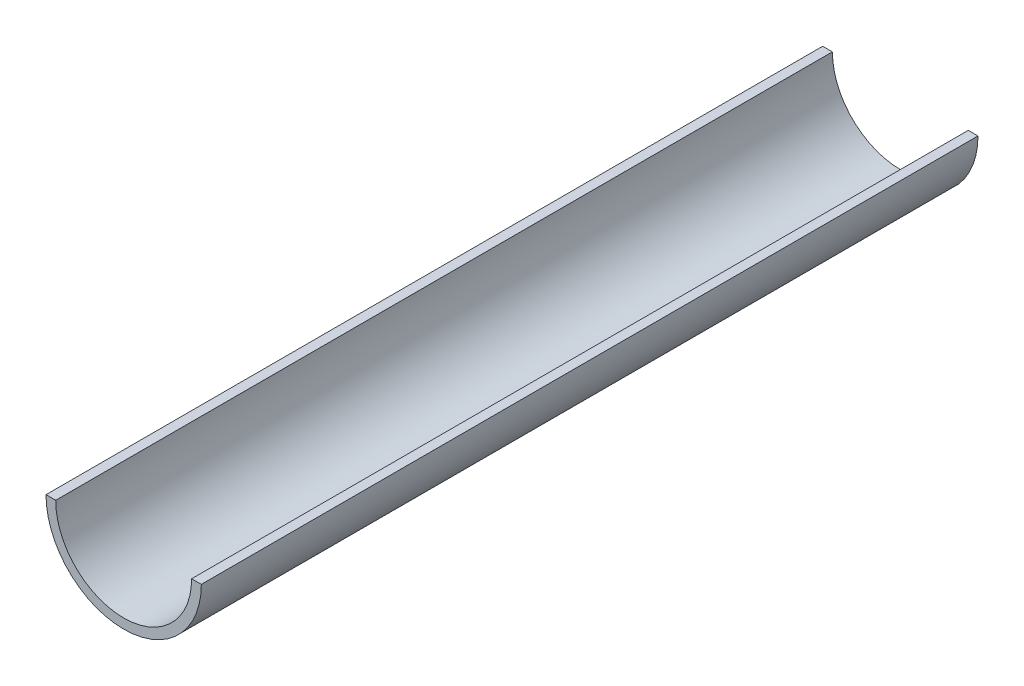
from build123d import *

# Parameters (mm, degrees)
SKETCH1_R           = 25.4
SKETCH1_R_2         = 22.225
BOSS_EXTRUDE1_DEPTH = 914.4
CUT_EXTRUDE1_START  = -254
SKETCH2_R           = 25.4
CUT_EXTRUDE1_DEPTH  = 662.10528356
CUT_EXTRUDE3_DEPTH  = 257.527425434


with BuildPart() as part:
    # Sketch1 → Boss-Extrude1 (new body)
    with BuildSketch(Plane.XY):
        Circle(SKETCH1_R)
        Circle(SKETCH1_R_2, mode=Mode.SUBTRACT)
    extrude(amount=BOSS_EXTRUDE1_DEPTH)

    # Sketch2 → Cut-Extrude1 (cut, through all)
    with BuildSketch(Plane(origin=(0, 0, 0), x_dir=(-1, 0, 0), z_dir=(0, 0, -1)).offset(CUT_EXTRUDE1_START)):
        Circle(SKETCH2_R)
    extrude(amount=-CUT_EXTRUDE1_DEPTH, mode=Mode.SUBTRACT)

    # Sketch4 → Cut-Extrude3 (cut, through all)
    with BuildSketch(Plane.XY):
        with BuildLine():
            Line((-25.4, 0), (25.4, 0))
            ThreePointArc((25.4, 0), (0, 25.4), (-25.4, 0))
        make_face()
    extrude(amount=CUT_EXTRUDE3_DEPTH, mode=Mode.SUBTRACT)


solid = part.part
